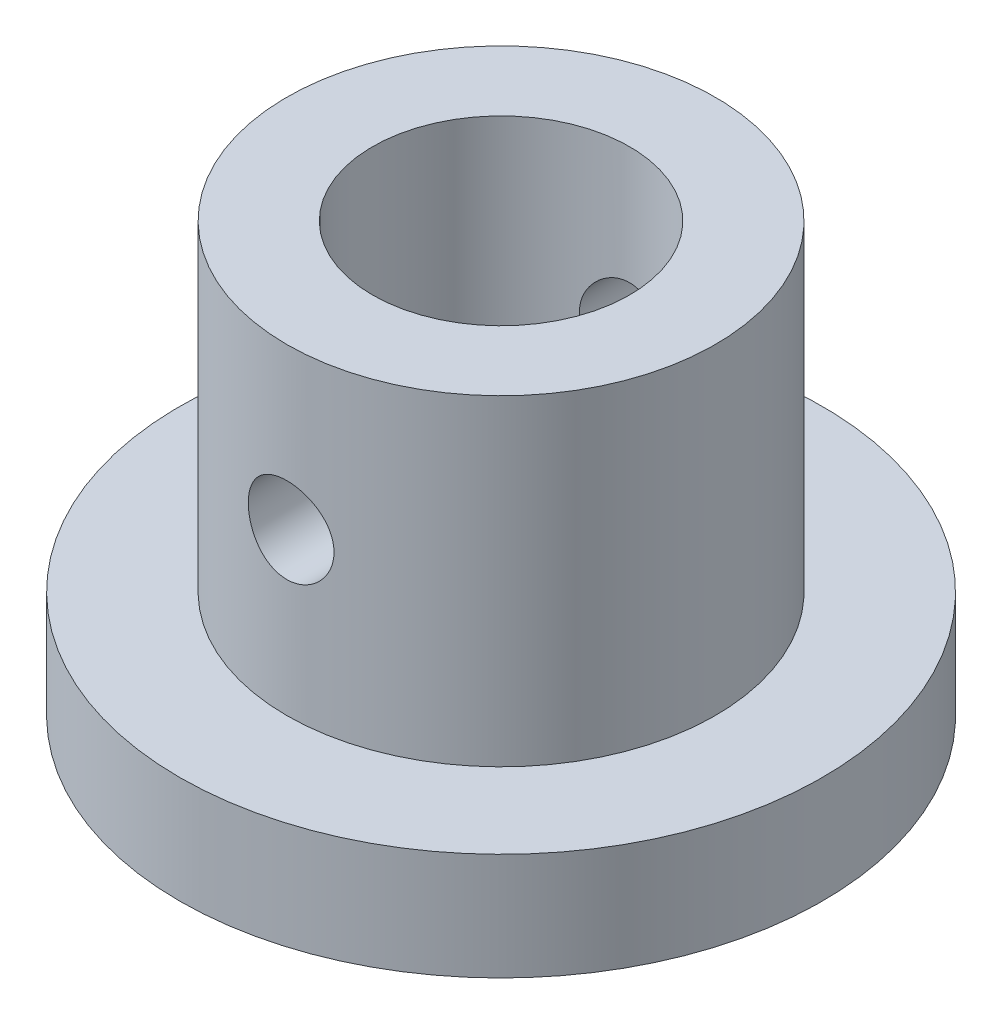
from build123d import *

# Parameters (mm, degrees)
IZIM1_R                     = 150
Y_KSEKLIK_EKSTR_ZYON2_DEPTH = 50
IZIM2_R                     = 100
Y_KSEKLIK_EKSTR_ZYON3_DEPTH = 150
IZIM3_R                     = 60
KES_EKSTR_ZYON1_DEPTH       = 292.547594742
IZIM4_R                     = 20
KES_EKSTR_ZYON2_DEPTH       = 130


with BuildPart() as part:
    # Çizim1 → Yükseklik-Ekstrüzyon2 (new body)
    with BuildSketch(Plane(origin=(0, 0, 0), x_dir=(1, 0, 0), z_dir=(0, 1, 0))):
        with Locations(Location((0, 0, 0), (0, 0, 270))):
            Circle(IZIM1_R)
    extrude(amount=Y_KSEKLIK_EKSTR_ZYON2_DEPTH)

    # Çizim2 → Yükseklik-Ekstrüzyon3 (add)
    with BuildSketch(Plane(origin=(0, 50, 0), x_dir=(1, 0, 0), z_dir=(0, 1, 0))):
        with Locations(Location((0, 0, 0), (0, 0, 270))):
            Circle(IZIM2_R)
    extrude(amount=Y_KSEKLIK_EKSTR_ZYON3_DEPTH)

    # Çizim3 → Kes-Ekstrüzyon1 (cut, through all)
    with BuildSketch(Plane(origin=(0, 200, 0), x_dir=(1, 0, 0), z_dir=(0, 1, 0))):
        with Locations(Location((0, 0, 0), (0, 0, 270))):
            Circle(IZIM3_R)
    extrude(amount=-KES_EKSTR_ZYON1_DEPTH, mode=Mode.SUBTRACT)

    # Çizim4 → Kes-Ekstrüzyon2 (cut, symmetric)
    with BuildSketch(Plane.XY):
        with Locations((0, 125)):
            Circle(IZIM4_R)
    extrude(amount=KES_EKSTR_ZYON2_DEPTH, both=True, mode=Mode.SUBTRACT)


solid = part.part
